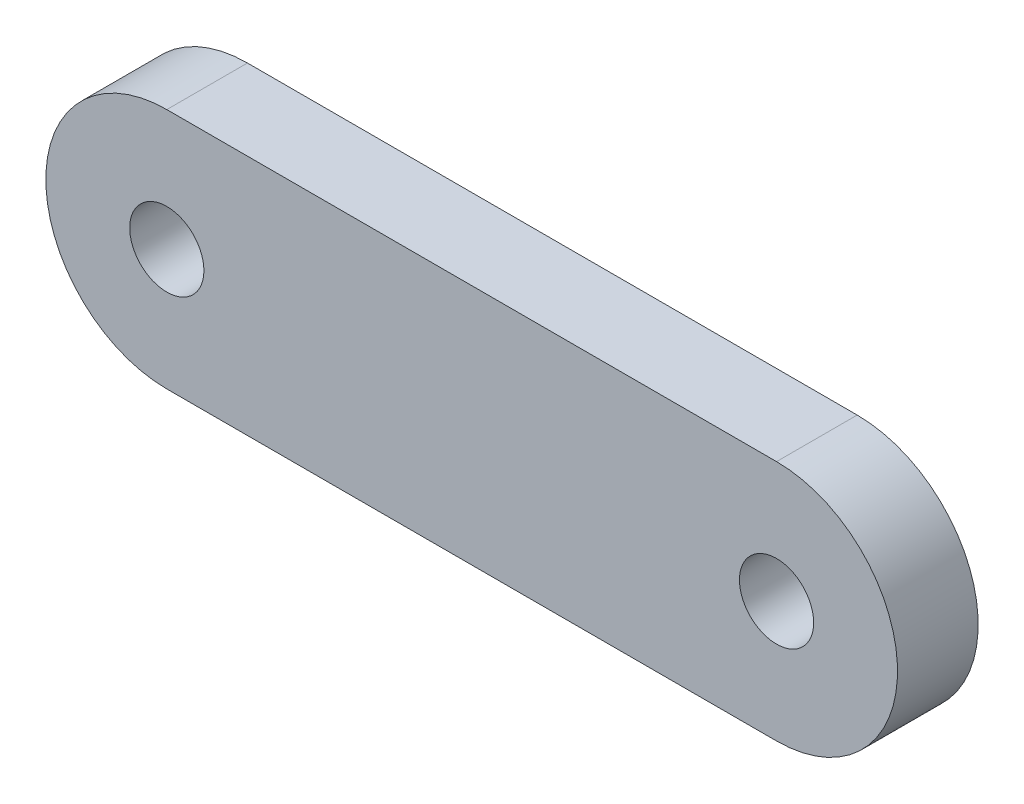
from build123d import *

# Parameters (mm, degrees)
SKETCH_1_R      = 2.3
EXTRUDE_1_DEPTH = 5


with BuildPart() as part:
    # 草图1 → 凸台-拉伸1 (new body)
    with BuildSketch(Plane.XY):
        with BuildLine():
            Line((-18.9, 7.5), (18.9, 7.5))
            ThreePointArc((18.9, 7.5), (26.4, 0), (18.9, -7.5))
            Line((18.9, -7.5), (-18.9, -7.5))
            ThreePointArc((-18.9, -7.5), (-26.4, 0), (-18.9, 7.5))
        make_face()
        with Locations((-18.9, 0)):
            Circle(SKETCH_1_R, mode=Mode.SUBTRACT)
        with Locations((18.9, 0)):
            Circle(SKETCH_1_R, mode=Mode.SUBTRACT)
    extrude(amount=EXTRUDE_1_DEPTH)


solid = part.part
